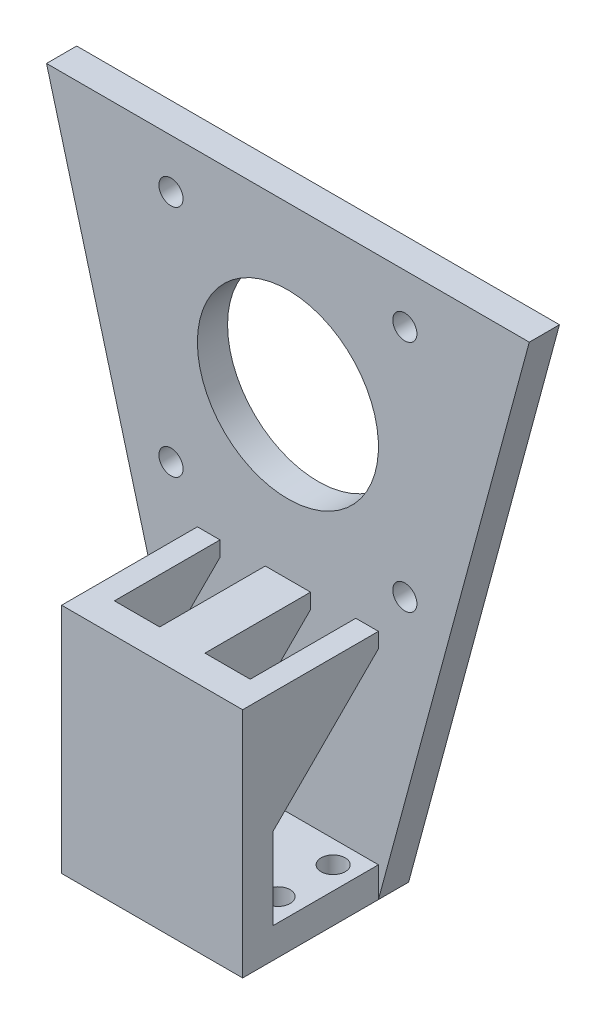
from build123d import *

# Parameters (mm, degrees)
SKETCH_1_W               = 24
SKETCH_1_H               = 14
SKETCH_1_R               = 1.6
EXTRUDE_1_DEPTH          = 4
SKETCH_3_W               = 24
SKETCH_3_H               = 4
EXTRUDE_2_DEPTH          = 4
SKETCH_5_W               = 24
SKETCH_5_H               = 4
EXTRUDE_3_DEPTH          = 70
SKETCH_8_W               = 24
SKETCH_8_H               = 4
EXTRUDE_4_DEPTH          = 4
SKETCH_9_W               = 24
SKETCH_9_H               = 4
EXTRUDE_5_DEPTH          = 70
EXTRUDE_7_DEPTH          = 4
SKETCH_14_W              = 24
SKETCH_14_H              = 4
CUT_EXTRUDE_2_DEPTH      = 43.2
EXTRUDE_8_DEPTH          = 24
CUT_EXTRUDE_3_DEPTH      = 3
CUT_EXTRUDE_3_DEPTH_BACK = 3
CUT_EXTRUDE_4_DEPTH      = 3
CUT_EXTRUDE_4_DEPTH_BACK = 3
CUT_EXTRUDE_6_REACH      = 90.859
SKETCH_11_R              = 12
SKETCH_11_R_2            = 1.6


with BuildPart() as part:
    # 草图1 → 凸台-拉伸1 (new body)
    with BuildSketch(Plane(origin=(0, 0, 0), x_dir=(1, 0, 0), z_dir=(0, 1, 0))):
        with Locations((12, -7)):
            Rectangle(SKETCH_1_W, SKETCH_1_H)
        with Locations(Location((3, -3, 0), (0, 0, 270))):
            Circle(SKETCH_1_R, mode=Mode.SUBTRACT)
        with Locations(Location((3.000002263, -11, 0), (0, 0, 270))):
            Circle(SKETCH_1_R, mode=Mode.SUBTRACT)
        with Locations(Location((21, -3, 0), (0, 0, 270))):
            Circle(SKETCH_1_R, mode=Mode.SUBTRACT)
        with Locations(Location((21.000002263, -10.308630824, 0), (0, 0, 270))):
            Circle(SKETCH_1_R, mode=Mode.SUBTRACT)
    extrude(amount=EXTRUDE_1_DEPTH)

    # 草图3 → 凸台-拉伸2 (add)
    with BuildSketch(Plane(origin=(0, 0, 0), x_dir=(-1, 0, 0), z_dir=(0, 0, -1))):
        with Locations((-12, 2)):
            Rectangle(SKETCH_3_W, SKETCH_3_H)
    extrude(amount=EXTRUDE_2_DEPTH)

    # 草图5 → 凸台-拉伸3 (add)
    with BuildSketch(Plane(origin=(0, 4, 0), x_dir=(1, 0, 0), z_dir=(0, 1, 0))):
        with Locations((12, 2)):
            Rectangle(SKETCH_5_W, SKETCH_5_H)
    extrude(amount=EXTRUDE_3_DEPTH)

    # 草图8 → 凸台-拉伸4 (add)
    with BuildSketch(Plane.XY.offset(14)):
        with Locations((12, 2)):
            Rectangle(SKETCH_8_W, SKETCH_8_H)
    extrude(amount=EXTRUDE_4_DEPTH)

    # 草图9 → 凸台-拉伸5 (add)
    with BuildSketch(Plane(origin=(0, 4, 0), x_dir=(1, 0, 0), z_dir=(0, 1, 0))):
        with Locations((12, -16)):
            Rectangle(SKETCH_9_W, SKETCH_9_H)
    extrude(amount=EXTRUDE_5_DEPTH)

    # 草图10 → 凸台-拉伸7 (add)
    with BuildSketch(Plane(origin=(0, 0, -4), x_dir=(-1, 0, 0), z_dir=(0, 0, -1))):
        Polygon((-24, 74), (0, 74), (20, 74), (0, 0), (-24, 0), (-44, 74), align=None)
    extrude(amount=-EXTRUDE_7_DEPTH)

    # 草图14 → 切除-拉伸2 (cut)
    with BuildSketch(Plane(origin=(0, 74, 0), x_dir=(1, 0, 0), z_dir=(0, 1, 0))):
        with Locations((12, -16)):
            Rectangle(SKETCH_14_W, SKETCH_14_H)
    extrude(amount=-CUT_EXTRUDE_2_DEPTH, mode=Mode.SUBTRACT)

    # 草图17 → 凸台-拉伸8 (add)
    with BuildSketch(Plane(origin=(24, 0, 0), x_dir=(0, 0, -1), z_dir=(1, 0, 0))):
        Polygon((-14, 30.8), (-14, 14.8), (0, 28.8), (0, 30.8), align=None)
    extrude(amount=-EXTRUDE_8_DEPTH)

    # 草图20 → 切除-拉伸3 (cut, two sides: drawn at the far end of the back side and taken through both)
    with BuildSketch(Plane.ZY.offset(-6).offset(-CUT_EXTRUDE_3_DEPTH_BACK)):
        Polygon((14, 30.8), (14, 14.8), (0, 28.8), (0, 30.8), align=None)
    extrude(amount=CUT_EXTRUDE_3_DEPTH + CUT_EXTRUDE_3_DEPTH_BACK, mode=Mode.SUBTRACT)

    # 草图21 → 切除-拉伸4 (cut, two sides: drawn at the far end of the back side and taken through both)
    with BuildSketch(Plane.ZY.offset(-18).offset(-CUT_EXTRUDE_4_DEPTH_BACK)):
        Polygon((14, 30.8), (14, 14.8), (0, 28.8), (0, 30.8), align=None)
    extrude(amount=CUT_EXTRUDE_4_DEPTH + CUT_EXTRUDE_4_DEPTH_BACK, mode=Mode.SUBTRACT)

    # 草图11 → 切除-拉伸6 (cut, up to next)
    with BuildSketch(Plane(origin=(0, 0, -4), x_dir=(-1, 0, 0), z_dir=(0, 0, -1)), mode=Mode.PRIVATE) as cut_extrude_6_sk1:
        with Locations((-12, 52)):
            Circle(SKETCH_11_R)
    cut_extrude_6_tool1 = extrude(cut_extrude_6_sk1.sketch, amount=-CUT_EXTRUDE_6_REACH, mode=Mode.PRIVATE) & part.part
    # 草图11 → 切除-拉伸6 (cut, up to next)
    with BuildSketch(Plane(origin=(0, 0, -4), x_dir=(-1, 0, 0), z_dir=(0, 0, -1)), mode=Mode.PRIVATE) as cut_extrude_6_sk2:
        with Locations((-27.5, 67.5)):
            Circle(SKETCH_11_R_2)
    cut_extrude_6_tool2 = extrude(cut_extrude_6_sk2.sketch, amount=-CUT_EXTRUDE_6_REACH, mode=Mode.PRIVATE) & part.part
    # 草图11 → 切除-拉伸6 (cut, up to next)
    with BuildSketch(Plane(origin=(0, 0, -4), x_dir=(-1, 0, 0), z_dir=(0, 0, -1)), mode=Mode.PRIVATE) as cut_extrude_6_sk3:
        with Locations((3.5, 67.5)):
            Circle(SKETCH_11_R_2)
    cut_extrude_6_tool3 = extrude(cut_extrude_6_sk3.sketch, amount=-CUT_EXTRUDE_6_REACH, mode=Mode.PRIVATE) & part.part
    # 草图11 → 切除-拉伸6 (cut, up to next)
    with BuildSketch(Plane(origin=(0, 0, -4), x_dir=(-1, 0, 0), z_dir=(0, 0, -1)), mode=Mode.PRIVATE) as cut_extrude_6_sk4:
        with Locations((3.5, 36.5)):
            Circle(SKETCH_11_R_2)
    cut_extrude_6_tool4 = extrude(cut_extrude_6_sk4.sketch, amount=-CUT_EXTRUDE_6_REACH, mode=Mode.PRIVATE) & part.part
    # 草图11 → 切除-拉伸6 (cut, up to next)
    with BuildSketch(Plane(origin=(0, 0, -4), x_dir=(-1, 0, 0), z_dir=(0, 0, -1)), mode=Mode.PRIVATE) as cut_extrude_6_sk5:
        with Locations((-27.5, 36.5)):
            Circle(SKETCH_11_R_2)
    cut_extrude_6_tool5 = extrude(cut_extrude_6_sk5.sketch, amount=-CUT_EXTRUDE_6_REACH, mode=Mode.PRIVATE) & part.part
    add(cut_extrude_6_tool1.solids().sort_by_distance((12, 52, -4))[0], mode=Mode.SUBTRACT)
    add(cut_extrude_6_tool2.solids().sort_by_distance((27.5, 67.5, -4))[0], mode=Mode.SUBTRACT)
    add(cut_extrude_6_tool3.solids().sort_by_distance((-3.5, 67.5, -4))[0], mode=Mode.SUBTRACT)
    add(cut_extrude_6_tool4.solids().sort_by_distance((-3.5, 36.5, -4))[0], mode=Mode.SUBTRACT)
    add(cut_extrude_6_tool5.solids().sort_by_distance((27.5, 36.5, -4))[0], mode=Mode.SUBTRACT)


solid = part.part
